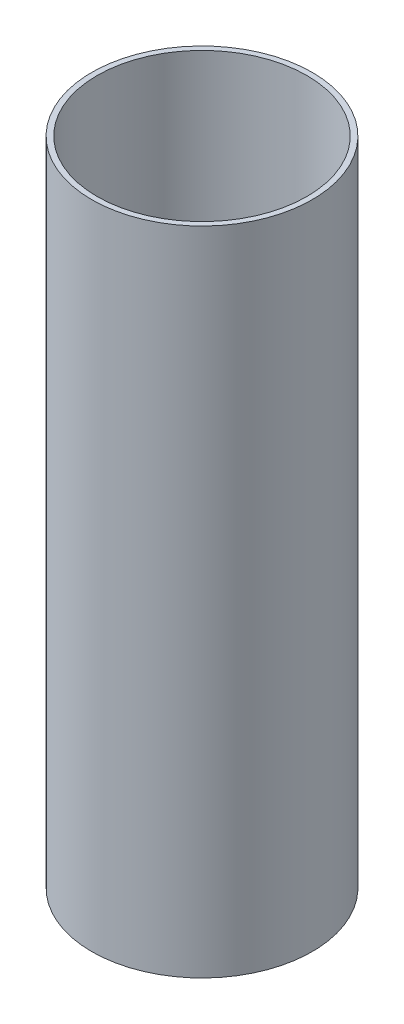
from build123d import *

# Parameters (mm, degrees)
SKETCH1_R           = 25.4
SKETCH1_R_2         = 24.1554
BOSS_EXTRUDE1_DEPTH = 150


with BuildPart() as part:
    # Sketch1 → Boss-Extrude1 (new body)
    with BuildSketch(Plane(origin=(0, 0, 0), x_dir=(1, 0, 0), z_dir=(0, 1, 0))):
        with Locations(Location((0, 0, 0), (0, 0, 270))):
            Circle(SKETCH1_R)
        with Locations(Location((0, 0, 0), (0, 0, 270))):
            Circle(SKETCH1_R_2, mode=Mode.SUBTRACT)
    extrude(amount=BOSS_EXTRUDE1_DEPTH)


solid = part.part
